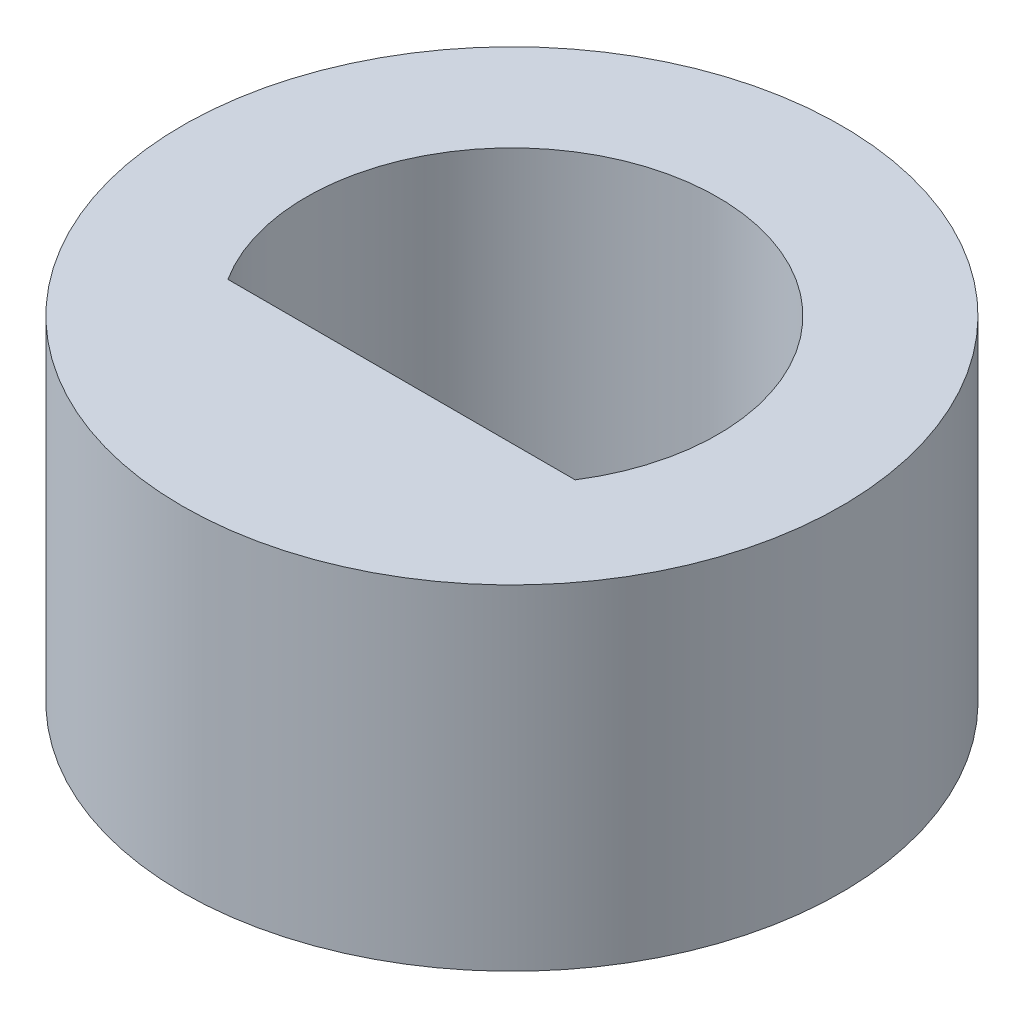
from build123d import *

# Parameters (mm, degrees)
SKETCH1_R           = 4.925
BOSS_EXTRUDE1_DEPTH = 5


with BuildPart() as part:
    # Sketch1 → Boss-Extrude1 (new body)
    with BuildSketch(Plane(origin=(0, 0, 0), x_dir=(1, 0, 0), z_dir=(0, 1, 0))):
        with Locations(Location((0, 0, 0), (0, 0, 270))):
            Circle(SKETCH1_R)
        with BuildLine():
            Line((-2.594826584, -1.65), (2.594826584, -1.65))
            ThreePointArc((2.594826584, -1.65), (0, 3.075), (-2.594826584, -1.65))
        make_face(mode=Mode.SUBTRACT)
    extrude(amount=BOSS_EXTRUDE1_DEPTH)


solid = part.part
